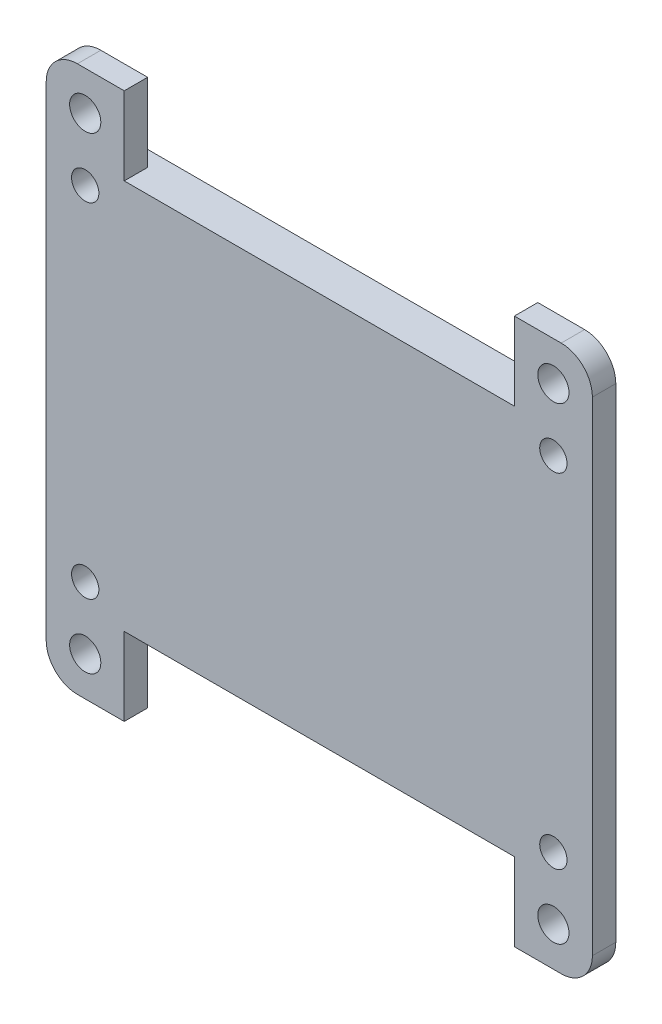
from build123d import *

# Parameters (mm, degrees)
SKETCH1_W           = 66
SKETCH1_H           = 50
SKETCH1_R           = 1.75
BOSS_EXTRUDE1_DEPTH = 2
FILLET1_R           = 3
BOSS_EXTRUDE2_START = 3
SKETCH2_R           = 1.75
SKETCH2_R_2         = 2
BOSS_EXTRUDE2_DEPTH = 3
FILLET2_R           = 4


with BuildPart() as part:
    # Sketch1 → Boss-Extrude1 (new body)
    with BuildSketch(Plane.XY):
        Rectangle(SKETCH1_W, SKETCH1_H)
        with Locations((-30, 22)):
            Circle(SKETCH1_R, mode=Mode.SUBTRACT)
        with Locations((30, 22)):
            Circle(SKETCH1_R, mode=Mode.SUBTRACT)
        with Locations(Location((30, -22, 0), (0, 0, 180))):
            Circle(SKETCH1_R, mode=Mode.SUBTRACT)
        with Locations(Location((-30, -22, 0), (0, 0, 180))):
            Circle(SKETCH1_R, mode=Mode.SUBTRACT)
    extrude(amount=BOSS_EXTRUDE1_DEPTH)

    # Fillet1
    fillet1_edges = [part.edges().sort_by_distance(p)[0] for p in [
        (33, -25, 1),
        (-33, -25, 1),
        (-33, 25, 1),
        (33, 25, 1),
    ]]
    fillet(fillet1_edges, radius=FILLET1_R)

    # Sketch2 → Boss-Extrude2 (add)
    # profile 1 of 3: a face of its own
    with BuildSketch(Plane.XY.offset(2).offset(BOSS_EXTRUDE2_START)):
        with BuildLine():
            ThreePointArc((-30, 25), (-32.121320344, 24.121320344), (-33, 22))
            Line((-33, 22), (-33, -22))
            ThreePointArc((-33, -22), (-32.121320344, -24.121320344), (-30, -25))
            Line((-30, -25), (30, -25))
            ThreePointArc((30, -25), (32.121320344, -24.121320344), (33, -22))
            Line((33, -22), (33, 22))
            ThreePointArc((33, 22), (32.121320344, 24.121320344), (30, 25))
            Line((30, 25), (-30, 25))
        make_face()
        with Locations((-30, 22)):
            Circle(SKETCH2_R, mode=Mode.SUBTRACT)
        with Locations(Location((30, -22, 0), (0, 0, 180))):
            Circle(SKETCH2_R, mode=Mode.SUBTRACT)
        with Locations(Location((-30, -22, 0), (0, 0, 180))):
            Circle(SKETCH2_R, mode=Mode.SUBTRACT)
        with Locations((30, 22)):
            Circle(SKETCH2_R, mode=Mode.SUBTRACT)
    # profile 2 of 3: a face of its own
    with BuildSketch(Plane.XY.offset(2).offset(BOSS_EXTRUDE2_START)):
        with BuildLine():
            Line((-35, 35), (-35, -35))
            Line((-35, -35), (-25, -35))
            Line((-25, -35), (-25, -25))
            Line((-25, -25), (-30, -25))
            ThreePointArc((-30, -25), (-32.121320344, -24.121320344), (-33, -22))
            Line((-33, -22), (-33, 22))
            ThreePointArc((-33, 22), (-32.121320344, 24.121320344), (-30, 25))
            Line((-30, 25), (-25, 25))
            Line((-25, 25), (-25, 35))
            Line((-25, 35), (-35, 35))
        make_face()
        with Locations((-30, -30)):
            Circle(SKETCH2_R_2, mode=Mode.SUBTRACT)
        with Locations((-30, 30)):
            Circle(SKETCH2_R_2, mode=Mode.SUBTRACT)
    # profile 3 of 3: a face of its own
    with BuildSketch(Plane.XY.offset(2).offset(BOSS_EXTRUDE2_START)):
        with BuildLine():
            Line((25, -25), (25, -35))
            Line((25, -35), (35, -35))
            Line((35, -35), (35, 35))
            Line((35, 35), (25, 35))
            Line((25, 35), (25, 25))
            Line((25, 25), (30, 25))
            ThreePointArc((30, 25), (32.121320344, 24.121320344), (33, 22))
            Line((33, 22), (33, -22))
            ThreePointArc((33, -22), (32.121320344, -24.121320344), (30, -25))
            Line((30, -25), (25, -25))
        make_face()
        with Locations((30, -30)):
            Circle(SKETCH2_R_2, mode=Mode.SUBTRACT)
        with Locations((30, 30)):
            Circle(SKETCH2_R_2, mode=Mode.SUBTRACT)
    extrude(amount=-BOSS_EXTRUDE2_DEPTH)

    # Fillet2
    fillet2_edges = [part.edges().sort_by_distance(p)[0] for p in [
        (35, -35, 3.5),
        (35, 35, 3.5),
        (-35, 35, 3.5),
        (-35, -35, 3.5),
    ]]
    fillet(fillet2_edges, radius=FILLET2_R)


solid = part.part
